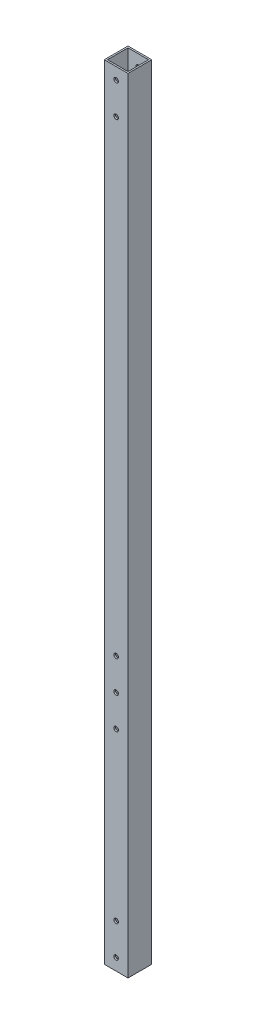
from build123d import *

# Parameters (mm, degrees)
SKETCH_1_W          = 15
SKETCH_1_H          = 15
SKETCH_1_W_2        = 13
SKETCH_1_H_2        = 13
EXTRUDE_1_DEPTH     = 495
SKETCH_2_R          = 1.45
CUT_EXTRUDE_1_DEPTH = 496.284009433


with BuildPart() as part:
    # 草图1 → 拉伸-薄壁1 (new body)
    with BuildSketch(Plane(origin=(0, 0, 0), x_dir=(1, 0, 0), z_dir=(0, 1, 0))):
        Rectangle(SKETCH_1_W, SKETCH_1_H)
        Rectangle(SKETCH_1_W_2, SKETCH_1_H_2, mode=Mode.SUBTRACT)
    extrude(amount=EXTRUDE_1_DEPTH)

    # 草图2 → 切除-拉伸1 (cut, through all)
    with BuildSketch(Plane.XY.offset(7.5)):
        with Locations((0, 487.5)):
            Circle(SKETCH_2_R)
        with Locations((0, 467.5)):
            Circle(SKETCH_2_R)
        with Locations((0, 27.5)):
            Circle(SKETCH_2_R)
        with Locations((0, 7.5)):
            Circle(SKETCH_2_R)
        with Locations((0, 152.5)):
            Circle(SKETCH_2_R)
        with Locations((0, 172.5)):
            Circle(SKETCH_2_R)
        with Locations((0, 132.5)):
            Circle(SKETCH_2_R)
    extrude(amount=-CUT_EXTRUDE_1_DEPTH, mode=Mode.SUBTRACT)


solid = part.part
